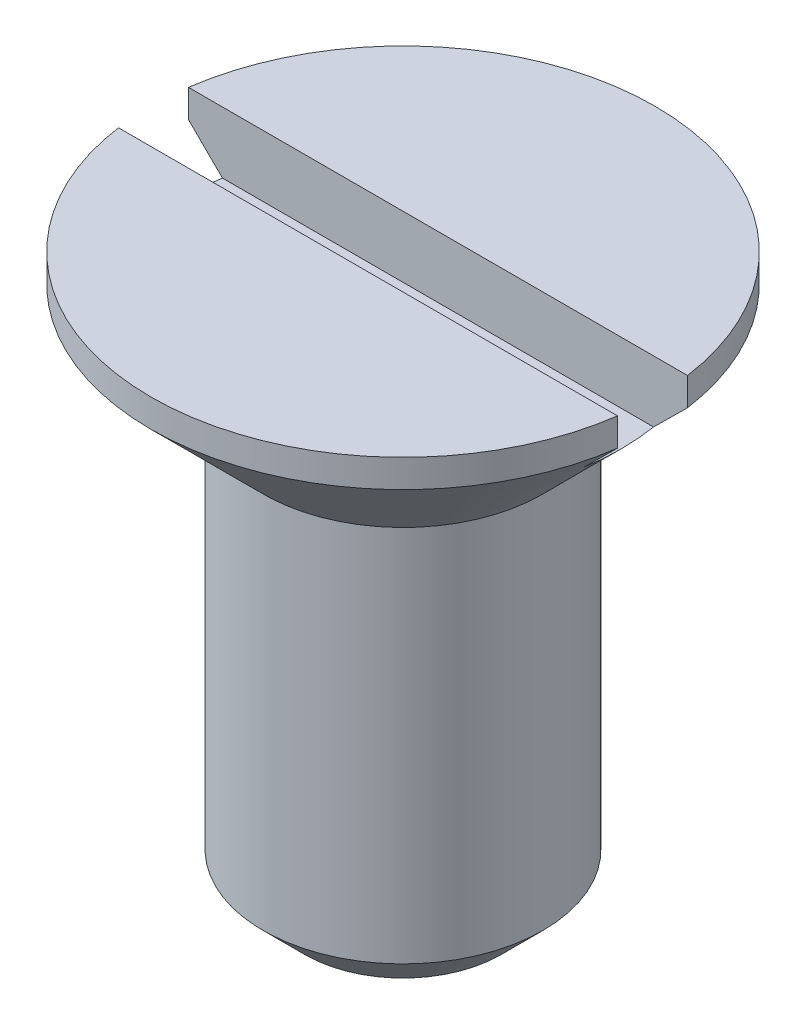
from build123d import *

# Parameters (mm, degrees)
SKETCH_13_W         = 18
SKETCH_13_H         = 2.5
CUT_EXTRUDE_9_DEPTH = 2.2
CHAMFER_1_SIZE      = 1.5


with BuildPart() as part:
    # Эскиз1 → Повернуть1 (revolve)
    with BuildSketch(Plane.XY):
        Polygon((0, 92.035042223), (0, 72.035042223), (5, 72.035042223), (5, 87.035042223), (9, 91.035042223), (9, 92.035042223), align=None)
    revolve(axis=Axis((0, 125.763182898, 0), (0, -1, 0)))

    # Эскиз13 → Вырез-Вытянуть9 (cut)
    with BuildSketch(Plane(origin=(0, 92.035042223, 0), x_dir=(-1, 0, 0), z_dir=(0, 1, 0))):
        Rectangle(SKETCH_13_W, SKETCH_13_H)
    extrude(amount=-CUT_EXTRUDE_9_DEPTH, mode=Mode.SUBTRACT)

    # Фаска1
    chamfer_1_edges = [part.edges().sort_by_distance(p)[0] for p in [
        (-5, 72.035042223, 0),
    ]]
    chamfer(chamfer_1_edges, length=CHAMFER_1_SIZE)


solid = part.part
